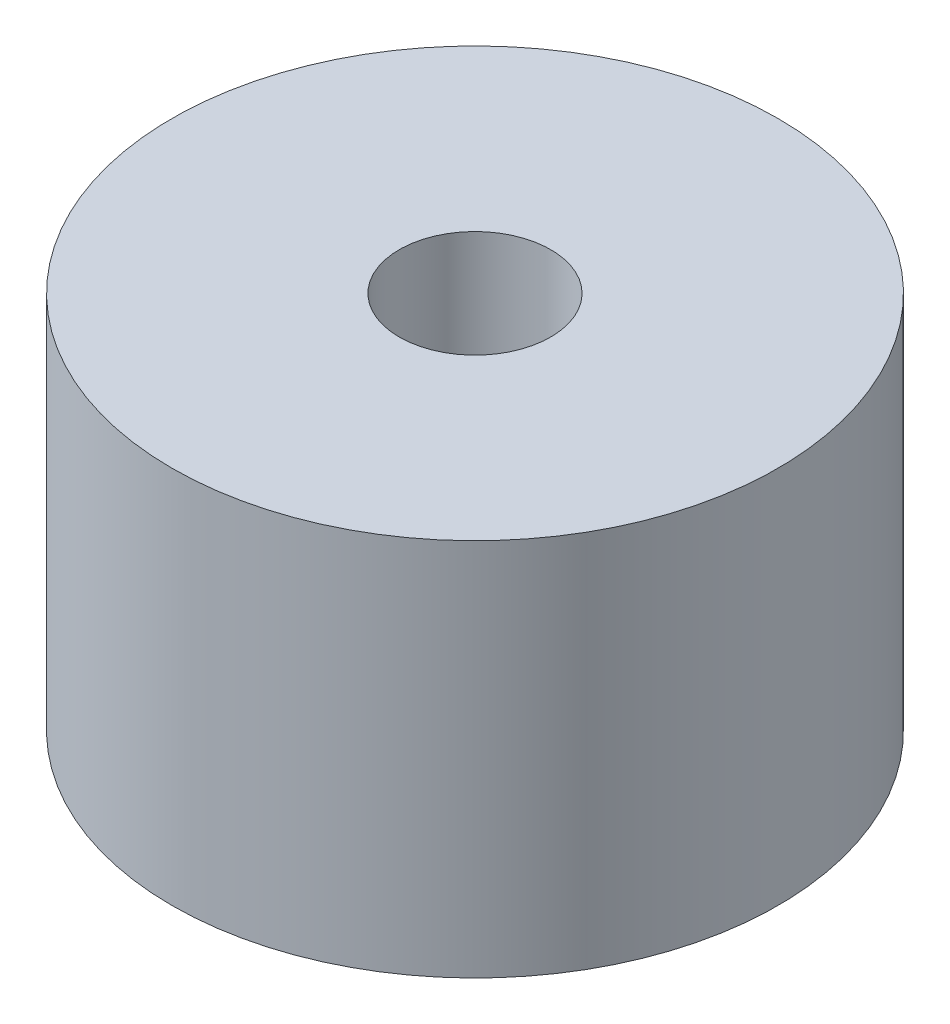
from build123d import *

# Parameters (mm, degrees)
SKETCH1_R           = 4
BOSS_EXTRUDE1_DEPTH = 5
SKETCH2_R           = 1
CUT_EXTRUDE1_DEPTH  = 5


with BuildPart() as part:
    # Sketch1 → Boss-Extrude1 (new body)
    with BuildSketch(Plane(origin=(0, 0, 0), x_dir=(1, 0, 0), z_dir=(0, 1, 0))):
        with Locations(Location((0, 0, 0), (0, 0, 270))):
            Circle(SKETCH1_R)
    extrude(amount=BOSS_EXTRUDE1_DEPTH)

    # Sketch2 → Cut-Extrude1 (cut)
    with BuildSketch(Plane(origin=(0, 5, 0), x_dir=(1, 0, 0), z_dir=(0, 1, 0))):
        with Locations(Location((0, 0, 0), (0, 0, 270))):
            Circle(SKETCH2_R)
    extrude(amount=-CUT_EXTRUDE1_DEPTH, mode=Mode.SUBTRACT)


solid = part.part
